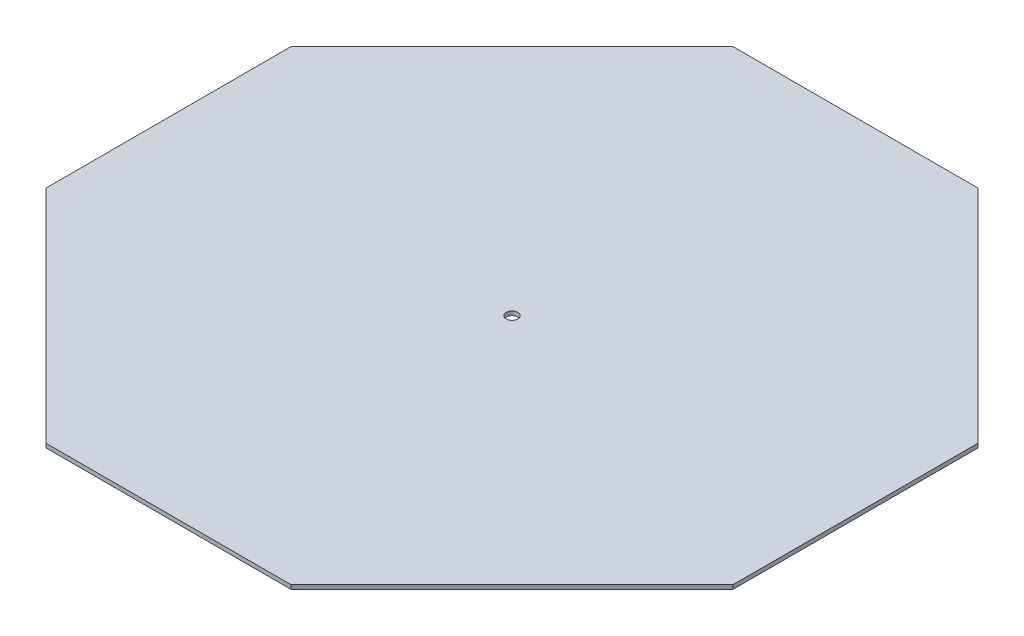
from build123d import *

# Parameters (mm, degrees)
BOSS_EXTRUDE1_DEPTH     = 3
CUT_EXTRUDE1_DEPTH      = 358.808608057
CUT_EXTRUDE1_DEPTH_BACK = 358.808608057
SKETCH2_R               = 4.25


with BuildPart() as part:
    # Sketch1 → Boss-Extrude1 (new body)
    with BuildSketch(Plane(origin=(0, 0, 0), x_dir=(1, 0, 0), z_dir=(0, 1, 0))):
        Polygon((-253, 90.242640687), (-90.242640687, 253), (90.242640687, 253), (253, 90.242640687), (253, -90.242640687), (90.242640687, -253), (-90.242640687, -253), (-253, -90.242640687), align=None)
    extrude(amount=BOSS_EXTRUDE1_DEPTH)

    # Sketch2 → Cut-Extrude1 (cut, two sides: drawn at the far end of the back side and taken through both)
    with BuildSketch(Plane(origin=(0, 3, 0), x_dir=(1, 0, 0), z_dir=(0, 1, 0)).offset(-CUT_EXTRUDE1_DEPTH_BACK)):
        with Locations(Location((0, 0, 0), (0, 0, 270))):
            Circle(SKETCH2_R)
    extrude(amount=CUT_EXTRUDE1_DEPTH + CUT_EXTRUDE1_DEPTH_BACK, mode=Mode.SUBTRACT)


solid = part.part
